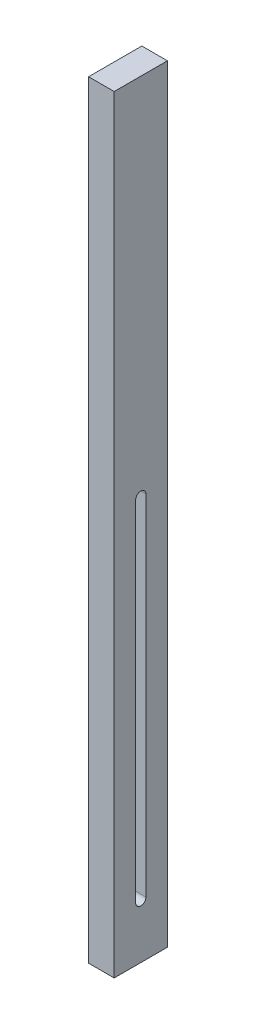
from build123d import *

# Parameters (mm, degrees)
SKETCH1_W           = 25
SKETCH1_H           = 52
BOSS_EXTRUDE1_DEPTH = 750
CUT_EXTRUDE2_DEPTH  = 40


with BuildPart() as part:
    # Sketch1 → Boss-Extrude1 (new body)
    with BuildSketch(Plane(origin=(0, 0, 0), x_dir=(1, 0, 0), z_dir=(0, 1, 0))):
        with Locations((-88.737623762, -4.094059406)):
            Rectangle(SKETCH1_W, SKETCH1_H)
    extrude(amount=BOSS_EXTRUDE1_DEPTH)

    # Sketch3 → Cut-Extrude2 (cut)
    with BuildSketch(Plane.ZY.offset(101.237623762)):
        with BuildLine():
            ThreePointArc((4.094059406, 58), (0.5585255, 56.535533906), (-0.905940594, 53))
            ThreePointArc((-0.905940594, 53), (0.5585255, 49.464466094), (4.094059406, 48))
            Line((4.094059406, 48), (4.094059406, 53))
            Line((4.094059406, 53), (4.094059406, 58))
        make_face()
        with BuildLine():
            ThreePointArc((9.094059406, 53), (7.629593312, 56.535533906), (4.094059406, 58))
            Line((4.094059406, 58), (4.094059406, 53))
            Line((4.094059406, 53), (4.094059406, 48))
            ThreePointArc((4.094059406, 48), (7.629593312, 49.464466094), (9.094059406, 53))
        make_face()
        with BuildLine():
            ThreePointArc((4.094059406, 58), (0.5585255, 56.535533906), (-0.905940594, 53))
            ThreePointArc((-0.905940594, 53), (0.5585255, 49.464466094), (4.094059406, 48))
            Line((4.094059406, 48), (4.094059406, 53))
            Line((4.094059406, 53), (4.094059406, 58))
        make_face()
        with BuildLine():
            ThreePointArc((9.094059406, 53), (7.629593312, 56.535533906), (4.094059406, 58))
            Line((4.094059406, 58), (4.094059406, 53))
            Line((4.094059406, 53), (4.094059406, 48))
            ThreePointArc((4.094059406, 48), (7.629593312, 49.464466094), (9.094059406, 53))
        make_face()
        with BuildLine():
            ThreePointArc((9.094059406, 394), (7.629593312, 390.464466094), (4.094059406, 389))
            Line((4.094059406, 389), (4.094059406, 58))
            ThreePointArc((4.094059406, 58), (7.629593312, 56.535533906), (9.094059406, 53))
            Line((9.094059406, 53), (9.094059406, 394))
        make_face()
        with BuildLine():
            ThreePointArc((4.094059406, 389), (0.5585255, 390.464466094), (-0.905940594, 394))
            Line((-0.905940594, 394), (-0.905940594, 53))
            ThreePointArc((-0.905940594, 53), (0.5585255, 56.535533906), (4.094059406, 58))
            Line((4.094059406, 58), (4.094059406, 389))
        make_face()
        with BuildLine():
            ThreePointArc((4.094059406, 399), (0.5585255, 397.535533906), (-0.905940594, 394))
            ThreePointArc((-0.905940594, 394), (0.5585255, 390.464466094), (4.094059406, 389))
            Line((4.094059406, 389), (4.094059406, 394))
            Line((4.094059406, 394), (4.094059406, 399))
        make_face()
        with BuildLine():
            ThreePointArc((9.094059406, 394), (7.629593312, 397.535533906), (4.094059406, 399))
            Line((4.094059406, 399), (4.094059406, 394))
            Line((4.094059406, 394), (4.094059406, 389))
            ThreePointArc((4.094059406, 389), (7.629593312, 390.464466094), (9.094059406, 394))
        make_face()
        with BuildLine():
            ThreePointArc((4.094059406, 399), (0.5585255, 397.535533906), (-0.905940594, 394))
            ThreePointArc((-0.905940594, 394), (0.5585255, 390.464466094), (4.094059406, 389))
            Line((4.094059406, 389), (4.094059406, 394))
            Line((4.094059406, 394), (4.094059406, 399))
        make_face()
        with BuildLine():
            ThreePointArc((9.094059406, 394), (7.629593312, 397.535533906), (4.094059406, 399))
            Line((4.094059406, 399), (4.094059406, 394))
            Line((4.094059406, 394), (4.094059406, 389))
            ThreePointArc((4.094059406, 389), (7.629593312, 390.464466094), (9.094059406, 394))
        make_face()
    extrude(amount=-CUT_EXTRUDE2_DEPTH, mode=Mode.SUBTRACT)


solid = part.part
